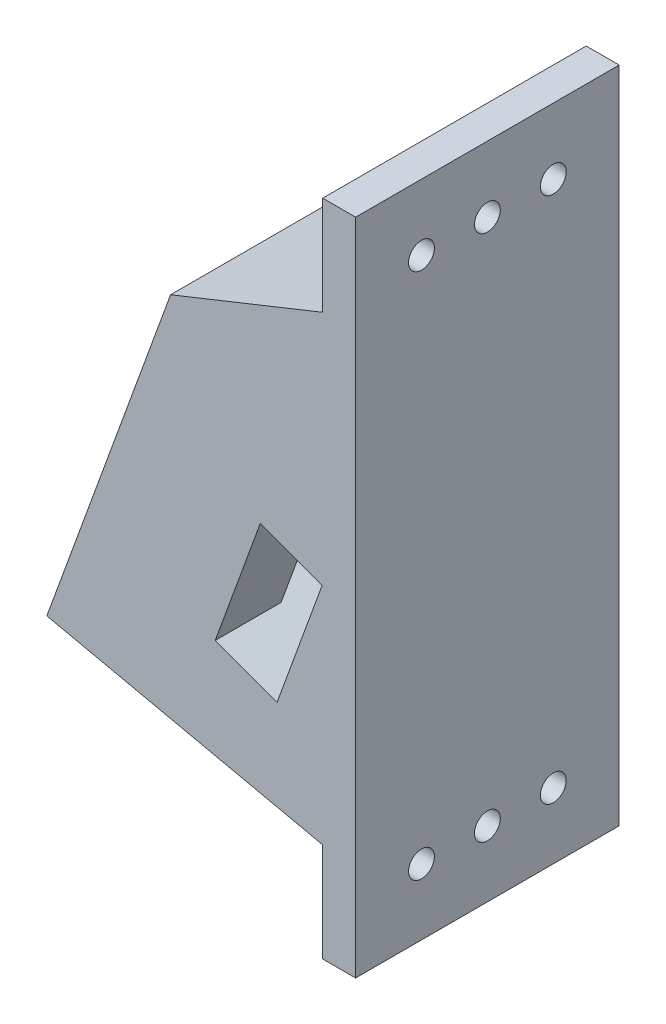
from build123d import *

# Parameters (mm, degrees)
BOSS_EXTRUDE1_DEPTH     = 50.8
SKETCH3_W               = 40
SKETCH3_H               = 45
CUT_EXTRUDE1_DEPTH      = 20
SKETCH4_R               = 2.4892
CUT_EXTRUDE2_DEPTH      = 17.78
SKETCH7_W               = 25.4
SKETCH7_H               = 25.4
CUT_EXTRUDE3_DEPTH      = 19.05
CUT_EXTRUDE4_DEPTH      = 119.867767025
CUT_EXTRUDE4_DEPTH_BACK = 119.867767025
SKETCH10_R              = 2.4892
CUT_EXTRUDE5_DEPTH      = 121.594574863
SKETCH11_R              = 2.54
BOSS_EXTRUDE2_DEPTH     = 5.08


with BuildPart() as part:
    # Sketch1 → Boss-Extrude1 (new body)
    with BuildSketch(Plane.XY):
        Polygon((0, 0), (0, -95.581585113), (-6.35, -95.581585113), (-6.35, -76.531585113), (-59.515515832, -64.891735517), (-35.66310566, 0.642222829), (-6.35, 12.368414887), (-6.35, 31.418414887), (0, 31.418414887), align=None)
    extrude(amount=BOSS_EXTRUDE1_DEPTH)

    # Sketch3 → Cut-Extrude1 (cut)
    with BuildSketch(Plane(origin=(-31.697721226, 11.53702702, 0), x_dir=(0, 0, 1), z_dir=(-0.9396926207859081, 0.34202014332566955, 0))):
        with Locations((25.4, -46.13379027)):
            Rectangle(SKETCH3_W, SKETCH3_H)
    extrude(amount=-CUT_EXTRUDE1_DEPTH, mode=Mode.SUBTRACT)

    # Sketch4 → Cut-Extrude2 (cut)
    with BuildSketch(Plane(origin=(-31.697721226, 11.53702702, 0), x_dir=(0, 0, 1), z_dir=(-0.9396926207859081, 0.34202014332566955, 0))):
        with Locations(Location((25.4, -17.28379027, 0), (0, 0, 270))):
            Circle(SKETCH4_R)
        with Locations(Location((25.4, -74.98379027, 0), (0, 0, 270))):
            Circle(SKETCH4_R)
    extrude(amount=-CUT_EXTRUDE2_DEPTH, mode=Mode.SUBTRACT)

    # Sketch7 → Cut-Extrude3 (cut)
    with BuildSketch(Plane(origin=(-12.90386881, 4.696624154, 0), x_dir=(0, 0, 1), z_dir=(-0.9396926207859082, 0.34202014332566955, 0))):
        with Locations((25.4, -46.13379027)):
            Rectangle(SKETCH7_W, SKETCH7_H)
    extrude(amount=-CUT_EXTRUDE3_DEPTH, mode=Mode.SUBTRACT)

    # Sketch9 → Cut-Extrude4 (cut, two sides: drawn at the far end of the back side and taken through both)
    with BuildSketch(Plane(origin=(0, 0, 38.1), x_dir=(-1, 0, 0), z_dir=(0, 0, -1)).offset(-CUT_EXTRUDE4_DEPTH_BACK)):
        Polygon((6.437754125, -33.236345579), (15.125065765, -57.104538146), (27.059162049, -52.760882326), (18.371850409, -28.892689758), align=None)
    extrude(amount=CUT_EXTRUDE4_DEPTH + CUT_EXTRUDE4_DEPTH_BACK, mode=Mode.SUBTRACT)

    # Sketch10 → Cut-Extrude5 (cut, through all)
    with BuildSketch(Plane.ZY.offset(6.35)):
        with Locations(Location((25.4, 18.718414887, 0), (0, 0, 270))):
            Circle(SKETCH10_R)
        with Locations(Location((12.7, 18.718414887, 0), (0, 0, 270))):
            Circle(SKETCH10_R)
        with Locations(Location((12.7, -82.881585113, 0), (0, 0, 270))):
            Circle(SKETCH10_R)
        with Locations(Location((38.1, -82.881585113, 0), (0, 0, 270))):
            Circle(SKETCH10_R)
        with Locations(Location((38.1, 18.718414887, 0), (0, 0, 270))):
            Circle(SKETCH10_R)
        with Locations(Location((25.4, -82.881585113, 0), (0, 0, 270))):
            Circle(SKETCH10_R)
    extrude(amount=-CUT_EXTRUDE5_DEPTH, mode=Mode.SUBTRACT)

    # Sketch11 → Boss-Extrude2 (add)
    with BuildSketch(Plane(origin=(-12.90386881, 4.696624154, 0), x_dir=(0, 0, 1), z_dir=(-0.9396926207859081, 0.3420201433256697, 0))):
        with Locations(Location((10.48, -28.71379027, 0), (0, 0, 90))):
            Circle(SKETCH11_R)
        with Locations(Location((40.32, -28.71379027, 0), (0, 0, 90))):
            Circle(SKETCH11_R)
        with Locations(Location((40.32, -63.55379027, 0), (0, 0, 90))):
            Circle(SKETCH11_R)
        with Locations(Location((10.48, -63.55379027, 0), (0, 0, 90))):
            Circle(SKETCH11_R)
    extrude(amount=BOSS_EXTRUDE2_DEPTH)


solid = part.part
